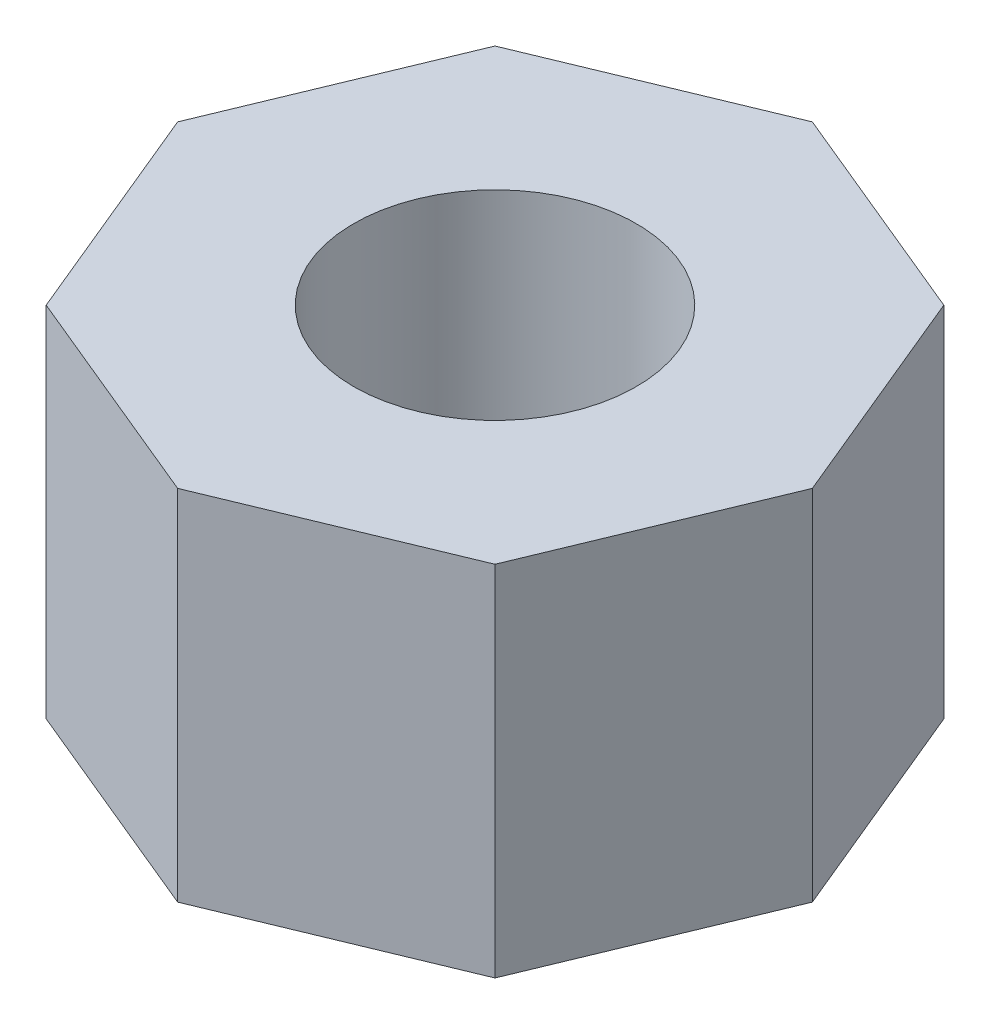
from build123d import *

# Parameters (mm, degrees)
SKETCH1_R           = 1.7526
BOSS_EXTRUDE1_DEPTH = 4.445


with BuildPart() as part:
    # Sketch1 → Boss-Extrude1 (new body)
    with BuildSketch(Plane(origin=(0, 0, 0), x_dir=(1, 0, 0), z_dir=(0, 1, 0))):
        Polygon((0, 3.937), (-2.783879398, 2.783879398), (-3.937, 0), (-2.783879398, -2.783879398), (0, -3.937), (2.783879398, -2.783879398), (3.937, 0), (2.783879398, 2.783879398), align=None)
        with Locations(Location((0, 0, 0), (0, 0, 270))):
            Circle(SKETCH1_R, mode=Mode.SUBTRACT)
    extrude(amount=BOSS_EXTRUDE1_DEPTH)


solid = part.part
